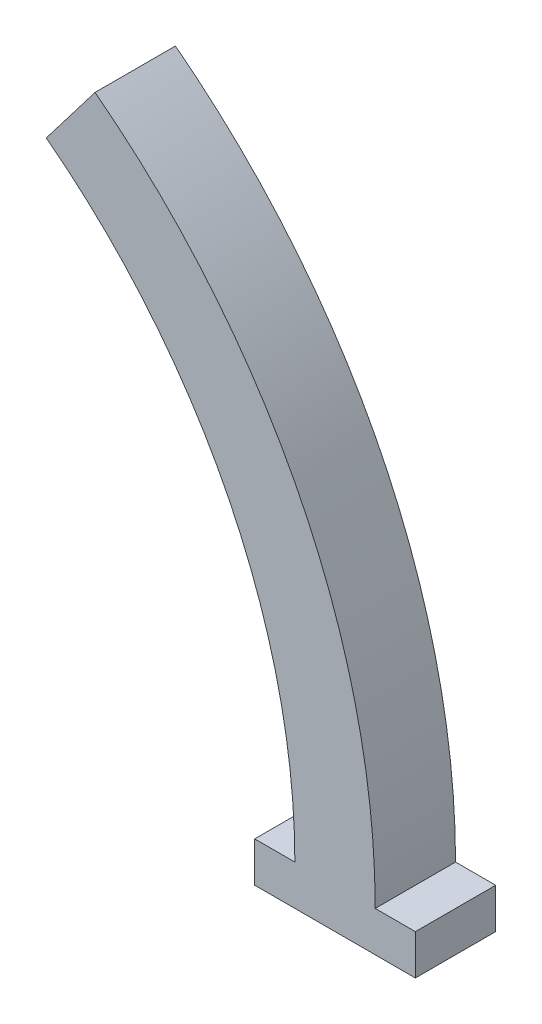
from build123d import *

# Parameters (mm, degrees)
SKETCH1_W           = 10.16
SKETCH1_H           = 5.08
BOSS_EXTRUDE1_DEPTH = 2.54
EXTRUDE_THIN1_DEPTH = 5.08


with BuildPart() as part:
    # Sketch1 → Boss-Extrude1 (new body)
    with BuildSketch(Plane(origin=(0, 0, 0), x_dir=(1, 0, 0), z_dir=(0, 1, 0))):
        with Locations((5.08, 2.54)):
            Rectangle(SKETCH1_W, SKETCH1_H)
    extrude(amount=BOSS_EXTRUDE1_DEPTH)

    # Sketch4 → Extrude-Thin1 (add)
    with BuildSketch(Plane(origin=(0, 0, 0), x_dir=(-1, 0, 0), z_dir=(0, 0, -1))):
        with BuildLine():
            ThreePointArc((-7.62, 2.54), (-2.949354511, 22.528719629), (10.095343756, 38.378000016))
            Line((10.095343756, 38.378000016), (13.180251735, 34.341944669))
            ThreePointArc((13.180251735, 34.341944669), (1.604640029, 20.277601299), (-2.54, 2.54))
            Line((-2.54, 2.54), (-7.62, 2.54))
        make_face()
    extrude(amount=EXTRUDE_THIN1_DEPTH)


solid = part.part
